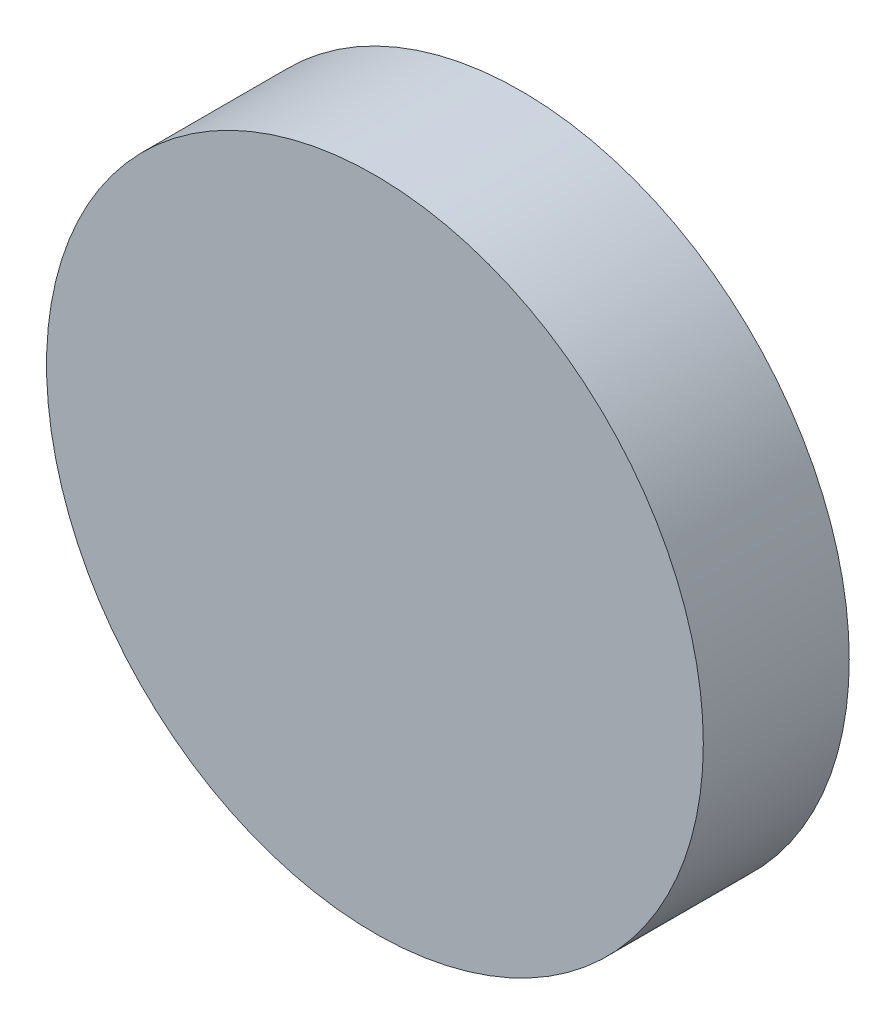
from build123d import *

# Parameters (mm, degrees)
SKETCH_1_R                     = 9
HEAD_AND_WASHER_ENVELOPE_DEPTH = 4


with BuildPart() as part:
    # 草图1 → Head_and_washer_envelope (new body)
    with BuildSketch(Plane.XY):
        Circle(SKETCH_1_R)
    extrude(amount=HEAD_AND_WASHER_ENVELOPE_DEPTH)


solid = part.part
